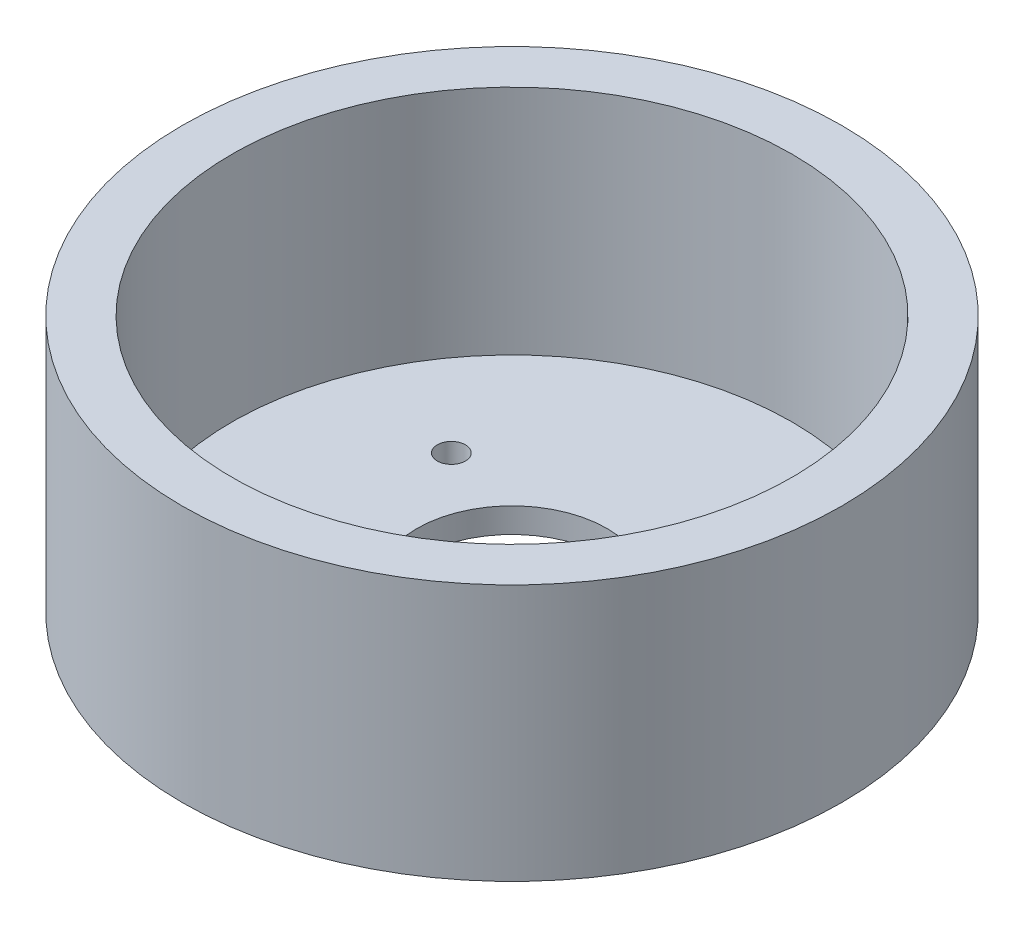
from build123d import *

# Parameters (mm, degrees)
SKETCH_2_R          = 11.5
SKETCH_2_R_2        = 1.7
CUT_EXTRUDE_1_DEPTH = 65.2579178


with BuildPart() as part:
    # 草图1 → 旋转1 (revolve)
    with BuildSketch(Plane.XY, mode=Mode.PRIVATE) as revolve_1_sk:
        Polygon((39.8, 31), (39.8, 0), (0, 0), (0, 3), (33.8, 3), (33.8, 31), align=None)
    revolve(revolve_1_sk.sketch.rotate(Axis((0, 0, 0), (0, 1, 0)), 90), axis=Axis((0, 0, 0), (0, 1, 0)))

    # 草图2 → 切除-拉伸1 (cut, through all)
    with BuildSketch(Plane.XZ):
        with Locations(Location((0, 0, 0), (0, 0, 270))):
            Circle(SKETCH_2_R)
        with Locations(Location((0, 20, 0), (0, 0, 270))):
            Circle(SKETCH_2_R_2)
        with Locations(Location((17.320508076, -10, 0), (0, 0, 270))):
            Circle(SKETCH_2_R_2)
        with Locations(Location((-17.320508076, -10, 0), (0, 0, 270))):
            Circle(SKETCH_2_R_2)
    extrude(amount=-CUT_EXTRUDE_1_DEPTH, mode=Mode.SUBTRACT)


solid = part.part
